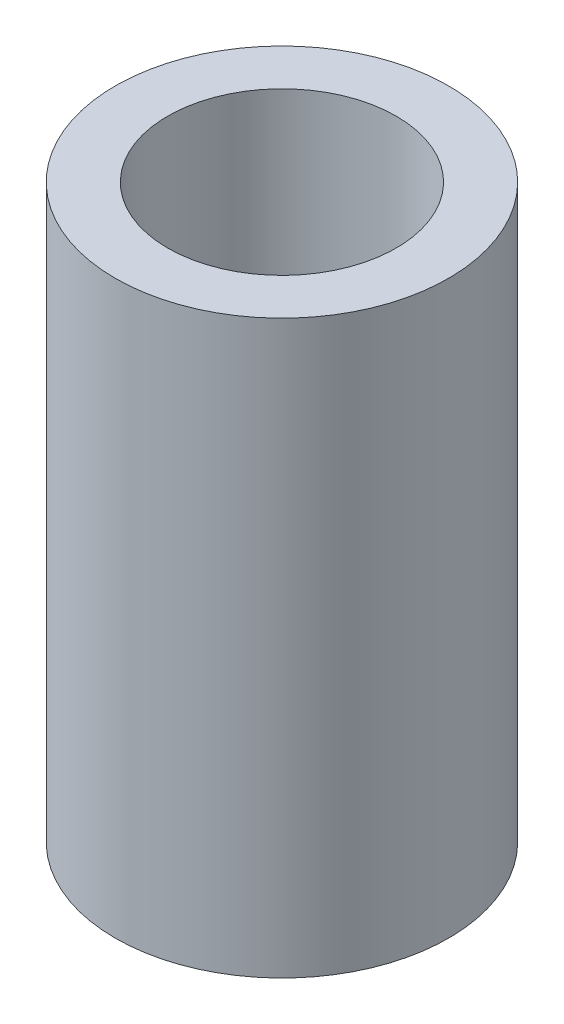
from build123d import *

# Parameters (mm, degrees)
SKETCH1_R           = 1.75
SKETCH1_R_2         = 1.2
BOSS_EXTRUDE1_DEPTH = 6


with BuildPart() as part:
    # Sketch1 → Boss-Extrude1 (new body)
    with BuildSketch(Plane(origin=(0, 0, 0), x_dir=(1, 0, 0), z_dir=(0, 1, 0))):
        with Locations(Location((0, 0, 0), (0, 0, 270))):
            Circle(SKETCH1_R)
        with Locations(Location((0, 0, 0), (0, 0, 270))):
            Circle(SKETCH1_R_2, mode=Mode.SUBTRACT)
    extrude(amount=BOSS_EXTRUDE1_DEPTH)


solid = part.part
